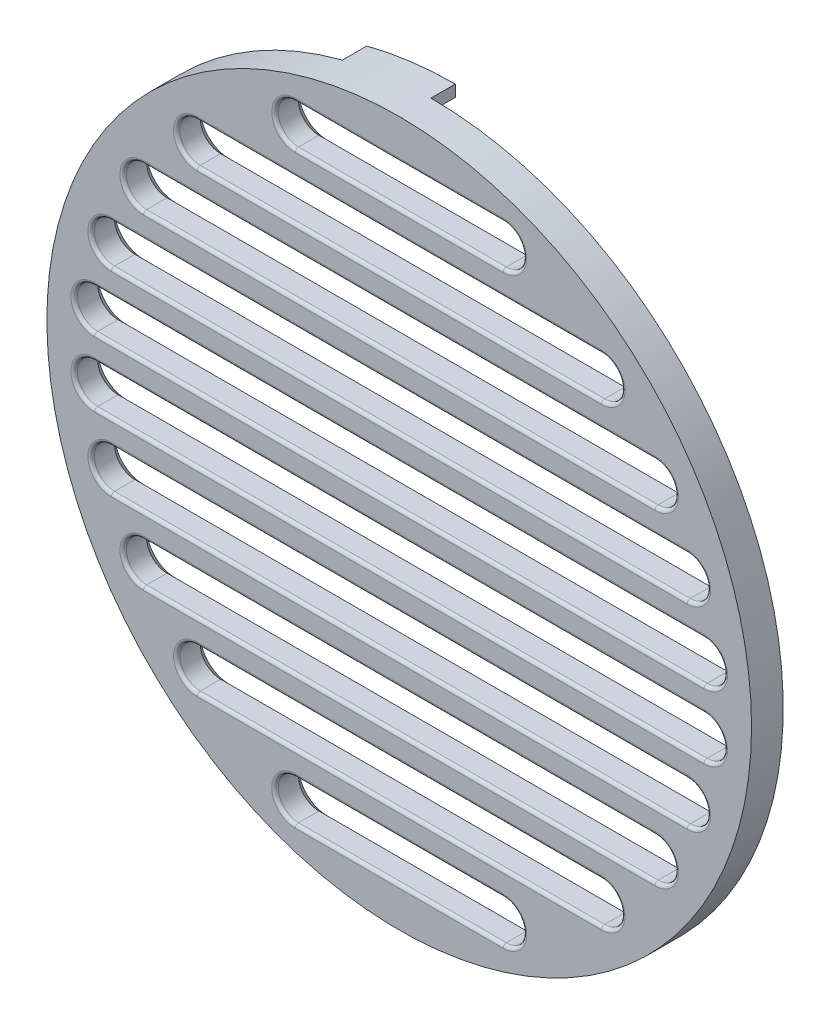
from build123d import *

# Parameters (mm, degrees)
CROQUIS1_R              = 21
SALIENTE_EXTRUIR1_DEPTH = 1.95
CROQUIS1_3_R            = 21.675
CROQUIS1_3_R_2          = 21
SALIENTE_EXTRUIR2_DEPTH = 1.95
CROQUIS2_W              = 1.5
CROQUIS2_H              = 0.711751017
REVOLUCI_N1_ANGLE       = 14.55
REDONDEO1_R             = 0.2
CHAFL_N1_SIZE           = 0.5
CHAFL_N2_SIZE           = 0.5


with BuildPart() as part:
    # Croquis1 → Saliente-Extruir1 (new body)
    with BuildSketch(Plane.XY):
        Circle(CROQUIS1_R)
        with BuildLine():
            Line((6.392705166, -19.25), (-6.392705166, -19.25))
            ThreePointArc((-6.392705166, -19.25), (-7.642705166, -18), (-6.392705166, -16.75))
            Line((-6.392705166, -16.75), (6.392705166, -16.75))
            ThreePointArc((6.392705166, -16.75), (7.642705166, -18), (6.392705166, -19.25))
        make_face(mode=Mode.SUBTRACT)
        with BuildLine():
            Line((12.437364718, -15.25), (-12.437364718, -15.25))
            ThreePointArc((-12.437364718, -15.25), (-13.687364718, -14), (-12.437364718, -12.75))
            Line((-12.437364718, -12.75), (12.437364718, -12.75))
            ThreePointArc((12.437364718, -12.75), (13.687364718, -14), (12.437364718, -15.25))
        make_face(mode=Mode.SUBTRACT)
        with BuildLine():
            Line((15.732385626, -11.25), (-15.732385626, -11.25))
            ThreePointArc((-15.732385626, -11.25), (-16.982385626, -10), (-15.732385626, -8.75))
            Line((-15.732385626, -8.75), (15.732385626, -8.75))
            ThreePointArc((15.732385626, -8.75), (16.982385626, -10), (15.732385626, -11.25))
        make_face(mode=Mode.SUBTRACT)
        with BuildLine():
            Line((17.708817824, -7.25), (-17.708817824, -7.25))
            ThreePointArc((-17.708817824, -7.25), (-18.958817824, -6), (-17.708817824, -4.75))
            Line((-17.708817824, -4.75), (17.708817824, -4.75))
            ThreePointArc((17.708817824, -4.75), (18.958817824, -6), (17.708817824, -7.25))
        make_face(mode=Mode.SUBTRACT)
        with BuildLine():
            Line((18.746987733, -3.25), (-18.746987733, -3.25))
            ThreePointArc((-18.746987733, -3.25), (-19.996987733, -2), (-18.746987733, -0.75))
            Line((-18.746987733, -0.75), (18.746987733, -0.75))
            ThreePointArc((18.746987733, -0.75), (19.996987733, -2), (18.746987733, -3.25))
        make_face(mode=Mode.SUBTRACT)
        with BuildLine():
            ThreePointArc((-18.746987733, 0.75), (-19.996987733, 2), (-18.746987733, 3.25))
            Line((-18.746987733, 3.25), (18.746987733, 3.25))
            ThreePointArc((18.746987733, 3.25), (19.996987733, 2), (18.746987733, 0.75))
            Line((18.746987733, 0.75), (-18.746987733, 0.75))
        make_face(mode=Mode.SUBTRACT)
        with BuildLine():
            ThreePointArc((-17.708817824, 4.75), (-18.958817824, 6), (-17.708817824, 7.25))
            Line((-17.708817824, 7.25), (17.708817824, 7.25))
            ThreePointArc((17.708817824, 7.25), (18.958817824, 6), (17.708817824, 4.75))
            Line((17.708817824, 4.75), (-17.708817824, 4.75))
        make_face(mode=Mode.SUBTRACT)
        with BuildLine():
            ThreePointArc((-15.732385626, 8.75), (-16.982385626, 10), (-15.732385626, 11.25))
            Line((-15.732385626, 11.25), (15.732385626, 11.25))
            ThreePointArc((15.732385626, 11.25), (16.982385626, 10), (15.732385626, 8.75))
            Line((15.732385626, 8.75), (-15.732385626, 8.75))
        make_face(mode=Mode.SUBTRACT)
        with BuildLine():
            ThreePointArc((-12.437364718, 12.75), (-13.687364718, 14), (-12.437364718, 15.25))
            Line((-12.437364718, 15.25), (12.437364718, 15.25))
            ThreePointArc((12.437364718, 15.25), (13.687364718, 14), (12.437364718, 12.75))
            Line((12.437364718, 12.75), (-12.437364718, 12.75))
        make_face(mode=Mode.SUBTRACT)
        with BuildLine():
            ThreePointArc((-6.392705166, 16.75), (-7.642705166, 18), (-6.392705166, 19.25))
            Line((-6.392705166, 19.25), (6.392705166, 19.25))
            ThreePointArc((6.392705166, 19.25), (7.642705166, 18), (6.392705166, 16.75))
            Line((6.392705166, 16.75), (-6.392705166, 16.75))
        make_face(mode=Mode.SUBTRACT)
    extrude(amount=SALIENTE_EXTRUIR1_DEPTH)

    # Croquis1<3> → Saliente-Extruir2 (add)
    with BuildSketch(Plane.XY):
        Circle(CROQUIS1_3_R)
        Circle(CROQUIS1_3_R_2, mode=Mode.SUBTRACT)
    extrude(amount=SALIENTE_EXTRUIR2_DEPTH)

    # Croquis2 → Revolución1 (revolve)
    with BuildSketch(Plane(origin=(0, 0, 0), x_dir=(0, 0, -1), z_dir=(1, 0, 0))):
        with Locations((0.75, 21.319124491)):
            Rectangle(CROQUIS2_W, CROQUIS2_H)
    revolve(axis=Axis((0, 0, 0), (0, 0, 1)), revolution_arc=REVOLUCI_N1_ANGLE)

    # Redondeo1
    redondeo1_edges = [part.edges().sort_by_distance(p)[0] for p in [
        (-7.642705166, -18, 1.95),
        (0, -19.25, 1.95),
        (7.642705166, -18, 1.95),
        (0, -16.75, 1.95),
        (-13.687364718, -14, 1.95),
        (0, -15.25, 1.95),
        (13.687364718, -14, 1.95),
        (0, -12.75, 1.95),
        (-16.982385626, -10, 1.95),
        (0, -11.25, 1.95),
        (16.982385626, -10, 1.95),
        (0, -8.75, 1.95),
        (-18.958817824, -6, 1.95),
        (0, -7.25, 1.95),
        (18.958817824, -6, 1.95),
        (0, -4.75, 1.95),
        (-19.996987733, -2, 1.95),
        (0, -3.25, 1.95),
        (19.996987733, -2, 1.95),
        (0, -0.75, 1.95),
        (-19.996987733, 2, 1.95),
        (0, 0.75, 1.95),
        (19.996987733, 2, 1.95),
        (0, 3.25, 1.95),
        (-18.958817824, 6, 1.95),
        (18.958817824, 6, 1.95),
        (0, 7.25, 1.95),
        (0, 4.75, 1.95),
        (-16.982385626, 10, 1.95),
        (0, 8.75, 1.95),
        (16.982385626, 10, 1.95),
        (0, 11.25, 1.95),
        (-13.687364718, 14, 1.95),
        (0, 12.75, 1.95),
        (13.687364718, 14, 1.95),
        (0, 15.25, 1.95),
        (0, 19.25, 1.95),
        (7.642705166, 18, 1.95),
        (-7.642705166, 18, 1.95),
        (0, 16.75, 1.95),
    ]]
    fillet(redondeo1_edges, radius=REDONDEO1_R)

    # Chaflán1
    chafl_n1_edges = [part.edges().sort_by_distance(p)[0] for p in [
        (-7.642705166, 18, 0),
        (0, 16.75, 0),
        (7.642705166, 18, 0),
        (0, 19.25, 0),
    ]]
    chamfer(chafl_n1_edges, length=CHAFL_N1_SIZE)

    # Chaflán2
    chafl_n2_edges = [part.edges().sort_by_distance(p)[0] for p in [
        (-16.982385626, 10, 0),
        (0, 8.75, 0),
        (16.982385626, 10, 0),
        (0, 11.25, 0),
        (-13.687364718, 14, 0),
        (0, 12.75, 0),
        (13.687364718, 14, 0),
        (0, 15.25, 0),
        (-7.642705166, -18, 0),
        (0, -19.25, 0),
        (7.642705166, -18, 0),
        (0, -16.75, 0),
        (-13.687364718, -14, 0),
        (0, -15.25, 0),
        (13.687364718, -14, 0),
        (0, -12.75, 0),
        (-16.982385626, -10, 0),
        (0, -11.25, 0),
        (16.982385626, -10, 0),
        (0, -8.75, 0),
        (-18.958817824, -6, 0),
        (0, -7.25, 0),
        (18.958817824, -6, 0),
        (0, -4.75, 0),
        (-19.996987733, -2, 0),
        (0, -3.25, 0),
        (19.996987733, -2, 0),
        (0, -0.75, 0),
        (0, 3.25, 0),
        (19.996987733, 2, 0),
        (0, 0.75, 0),
        (-19.996987733, 2, 0),
        (0, 4.75, 0),
        (-18.958817824, 6, 0),
        (18.958817824, 6, 0),
        (0, 7.25, 0),
    ]]
    chamfer(chafl_n2_edges, length=CHAFL_N2_SIZE)


solid = part.part
